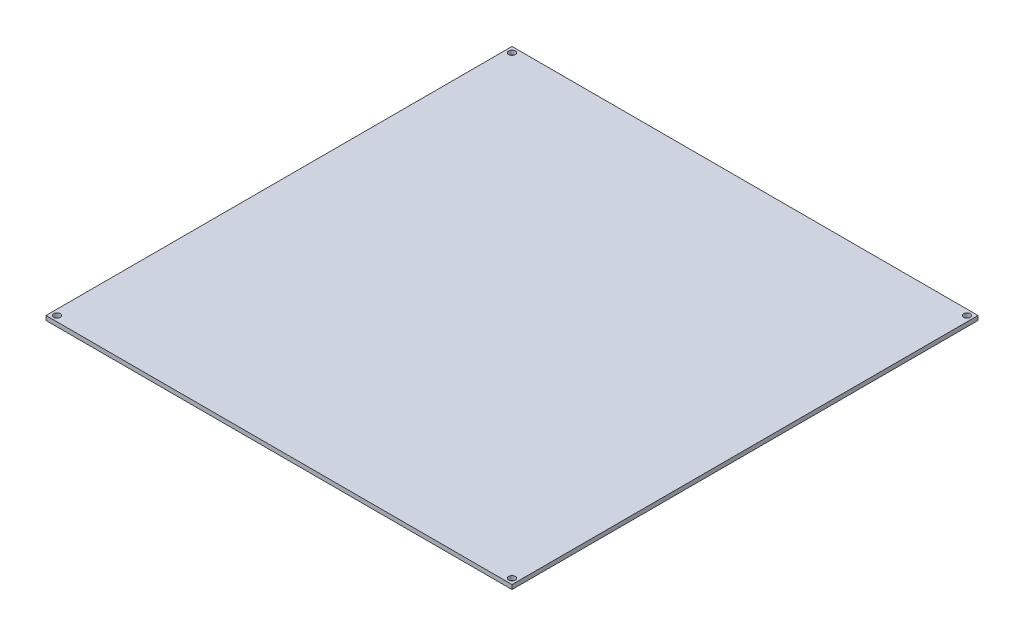
from build123d import *

# Parameters (mm, degrees)
SKETCH1_W               = 214
SKETCH1_H               = 214
BOSS_EXTRUDE1_DEPTH     = 2
CUT_EXTRUDE1_DEPTH      = 152.334067546
CUT_EXTRUDE1_DEPTH_BACK = 152.334067546
SKETCH3_R               = 1.5


with BuildPart() as part:
    # Sketch1 → Boss-Extrude1 (new body)
    with BuildSketch(Plane(origin=(0, 0, 0), x_dir=(1, 0, 0), z_dir=(0, 1, 0))):
        Rectangle(SKETCH1_W, SKETCH1_H)
    extrude(amount=BOSS_EXTRUDE1_DEPTH)

    # Sketch3 → Cut-Extrude1 (cut, two sides: drawn at the far end of the back side and taken through both)
    with BuildSketch(Plane(origin=(0, 2, 0), x_dir=(1, 0, 0), z_dir=(0, 1, 0)).offset(-CUT_EXTRUDE1_DEPTH_BACK)):
        with Locations(Location((-104.5, 104.5, 0), (0, 0, 270))):
            Circle(SKETCH3_R)
        with Locations(Location((104.5, 104.5, 0), (0, 0, 270))):
            Circle(SKETCH3_R)
        with Locations(Location((104.5, -104.5, 0), (0, 0, 270))):
            Circle(SKETCH3_R)
        with Locations(Location((-104.5, -104.5, 0), (0, 0, 270))):
            Circle(SKETCH3_R)
    extrude(amount=CUT_EXTRUDE1_DEPTH + CUT_EXTRUDE1_DEPTH_BACK, mode=Mode.SUBTRACT)


solid = part.part
